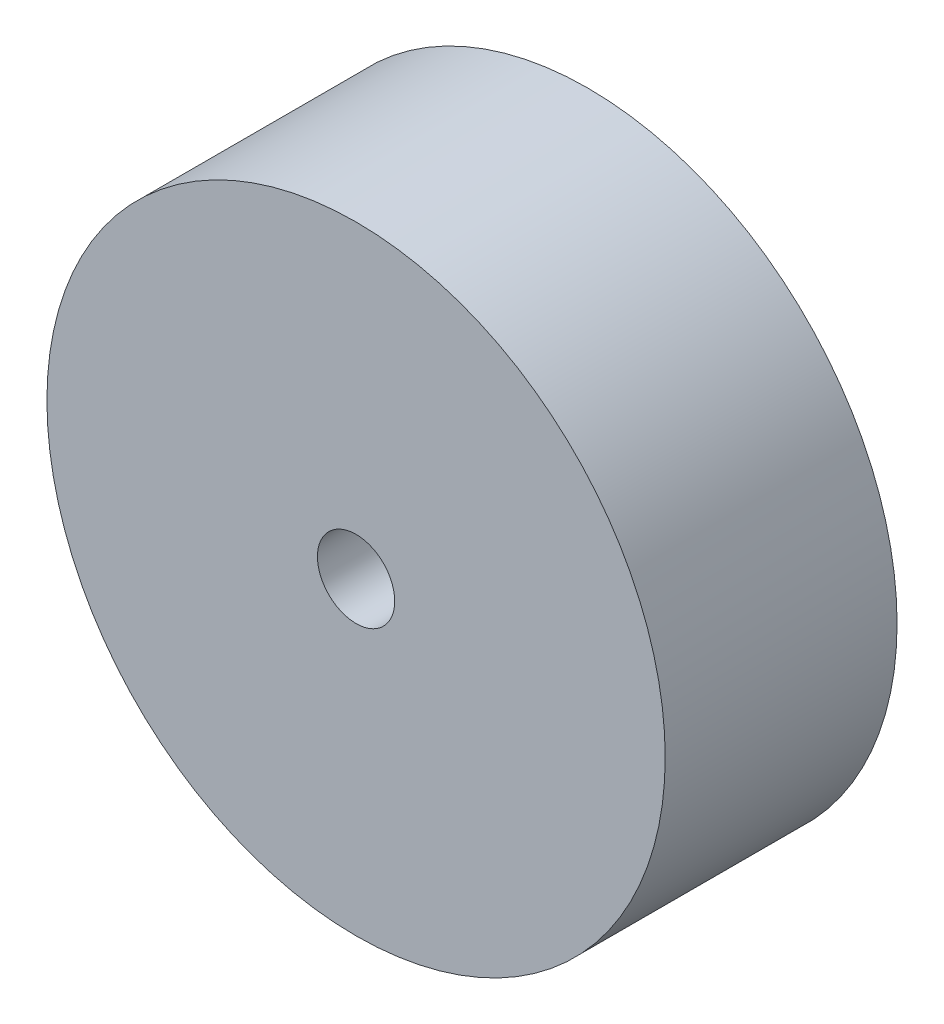
from build123d import *

# Parameters (mm, degrees)
SKETCH1_R               = 101.6
BOSS_EXTRUDE1_DEPTH     = 76.2
CUT_EXTRUDE1_DEPTH      = 163.639355631
CUT_EXTRUDE1_DEPTH_BACK = 163.639355631
SKETCH2_R               = 12.7


with BuildPart() as part:
    # Sketch1 → Boss-Extrude1 (new body)
    with BuildSketch(Plane.XY):
        Circle(SKETCH1_R)
    extrude(amount=-BOSS_EXTRUDE1_DEPTH)

    # Sketch2 → Cut-Extrude1 (cut, two sides: drawn at the far end of the back side and taken through both)
    with BuildSketch(Plane.XY.offset(-CUT_EXTRUDE1_DEPTH_BACK)):
        Circle(SKETCH2_R)
    extrude(amount=CUT_EXTRUDE1_DEPTH + CUT_EXTRUDE1_DEPTH_BACK, mode=Mode.SUBTRACT)


solid = part.part
